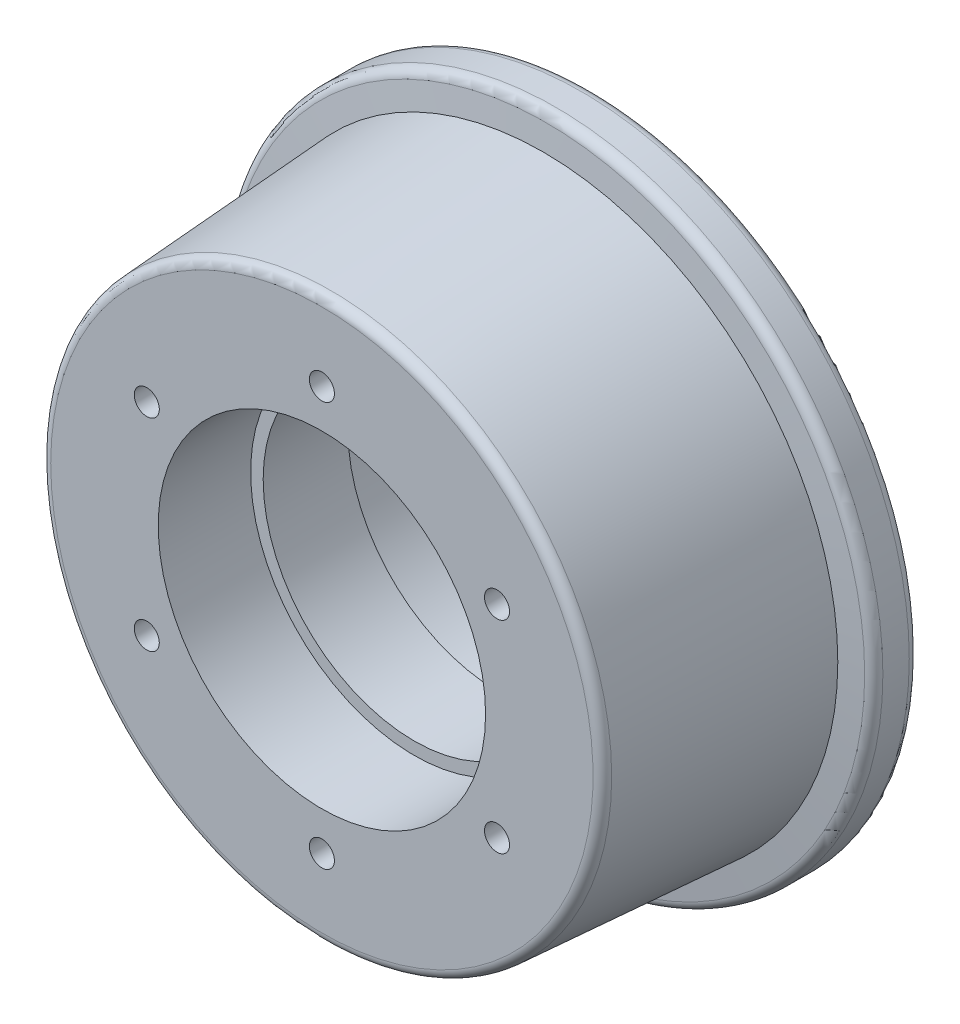
from build123d import *

# Parameters (mm, degrees)
FILLET_2_R               = 5
SKETCH_2_R               = 6.5
CUT_EXTRUDE_1_DEPTH      = 25
PATTERN_CIRCULAR_1_COUNT = 6
SKETCH_3_R               = 8
CUT_EXTRUDE_2_DEPTH      = 35
PATTERN_CIRCULAR_2_COUNT = 6


with BuildPart() as part:
    # 草图1 → 旋转1 (revolve)
    with BuildSketch(Plane(origin=(0, 0, 0), x_dir=(0, 0, -1), z_dir=(1, 0, 0)), mode=Mode.PRIVATE) as revolve_1_sk:
        Polygon((-22, 78.5), (22, 78.5), (22, 85), (75, 85), (75, 140), (70, 140), (70, 170), (46.798033168, 170), (45, 152.892857143), (-70, 145.5), (-70, 85), (-22, 85), align=None)
    revolve(revolve_1_sk.sketch.rotate(Axis((0, 0, 1000), (0, 0, -1)), 90), axis=Axis((0, 0, 1000), (0, 0, -1)))

    # 圆角2
    fillet_2_edges = [part.edges().sort_by_distance(p)[0] for p in [
        (-170, 0, -46.798033168),
        (-170, 0, -70),
        (-145.5, 0, 70),
    ]]
    fillet(fillet_2_edges, radius=FILLET_2_R)

    # 草图2 → 切除-拉伸1 (cut)
    with BuildSketch(Plane.XY.offset(70)):
        with Locations((0, 105)):
            Circle(SKETCH_2_R)
    cut_extrude_1 = extrude(amount=-CUT_EXTRUDE_1_DEPTH, mode=Mode.SUBTRACT)

    # 阵列(圆周)1: 切除-拉伸1 ×6 about axis
    pattern_circular_1_axis = Axis((0, 0, 0), (0, 0, 1))
    for i in range(1, PATTERN_CIRCULAR_1_COUNT):
        add(cut_extrude_1.rotate(pattern_circular_1_axis, i * 360 / PATTERN_CIRCULAR_1_COUNT), mode=Mode.SUBTRACT)

    # 草图3 → 切除-拉伸2 (cut)
    with BuildSketch(Plane(origin=(0, 0, -75), x_dir=(-1, 0, 0), z_dir=(0, 0, -1))):
        with Locations((0, 115)):
            Circle(SKETCH_3_R)
    cut_extrude_2 = extrude(amount=-CUT_EXTRUDE_2_DEPTH, mode=Mode.SUBTRACT)

    # 阵列(圆周)2: 切除-拉伸2 ×6 about axis
    pattern_circular_2_axis = Axis((0, 0, 0), (0, 0, 1))
    for i in range(1, PATTERN_CIRCULAR_2_COUNT):
        add(cut_extrude_2.rotate(pattern_circular_2_axis, i * 360 / PATTERN_CIRCULAR_2_COUNT), mode=Mode.SUBTRACT)


solid = part.part
